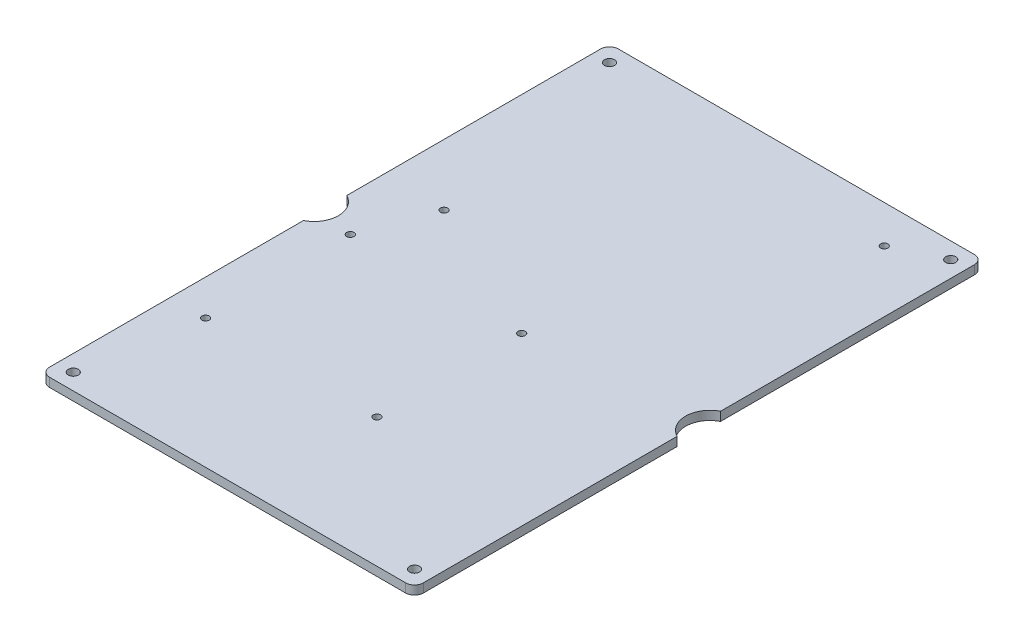
from build123d import *

# Parameters (mm, degrees)
SKETCH1_W            = 126.5
SKETCH1_H            = 192.5
BOSS_EXTRUDE1_DEPTH  = 3
CUT_EXTRUDE1_REACH   = 117.211
SKETCH2_R            = 8.25
M3_CLEARANCE_HOLE1_D = 3.4
FILLET1_R            = 3
M3_TAPPED_HOLE1_D    = 2.46


with BuildPart() as part:
    # Sketch1 → Boss-Extrude1 (new body)
    with BuildSketch(Plane(origin=(0, 0, 0), x_dir=(1, 0, 0), z_dir=(0, 1, 0))):
        Rectangle(SKETCH1_W, SKETCH1_H)
    extrude(amount=BOSS_EXTRUDE1_DEPTH)

    # Sketch2 → Cut-Extrude1 (cut, up to next)
    with BuildSketch(Plane(origin=(0, 3, 0), x_dir=(1, 0, 0), z_dir=(0, 1, 0)), mode=Mode.PRIVATE) as cut_extrude1_sk1:
        with Locations((67, 0)):
            Circle(SKETCH2_R)
    cut_extrude1_tool1 = extrude(cut_extrude1_sk1.sketch, amount=-CUT_EXTRUDE1_REACH, mode=Mode.PRIVATE) & part.part
    cut_extrude1 = cut_extrude1_tool1.solids().sort_by_distance((67, 3, 0))[0]
    add(cut_extrude1, mode=Mode.SUBTRACT)

    # Mirror1: Cut-Extrude1 across plane
    add(cut_extrude1.mirror(Plane(origin=(0, 0, 0), x_dir=(0, 0, 1), z_dir=(1, 0, 0))), mode=Mode.SUBTRACT)

    # M3 Clearance Hole1 (through all)
    with Locations(Plane(origin=(0, 3, 0), x_dir=(1, 0, 0), z_dir=(0, 1, 0))):
        with Locations((-57.75, 90.75), (57.75, -90.75), (57.75, 90.75), (-57.75, -90.75)):
            Hole(M3_CLEARANCE_HOLE1_D / 2)

    # Fillet1
    fillet1_edges = [part.edges().sort_by_distance(p)[0] for p in [
        (63.25, 1.5, 96.25),
        (-63.25, 1.5, 96.25),
        (-63.25, 1.5, -96.25),
        (63.25, 1.5, -96.25),
    ]]
    fillet(fillet1_edges, radius=FILLET1_R)

    # M3 Tapped Hole1 (through all)
    with Locations(Plane(origin=(0, 0, 0), x_dir=(-1, 0, 0), z_dir=(0, -1, 0))):
        with Locations((-6.773037989, -52.5), (-42.49999882, 83.49999962), (42.50000136, 19.50000062), (-6.773037989, -3.5), (51.226962011, -3.5), (51.226962011, -52.5)):
            Hole(M3_TAPPED_HOLE1_D / 2)


solid = part.part
